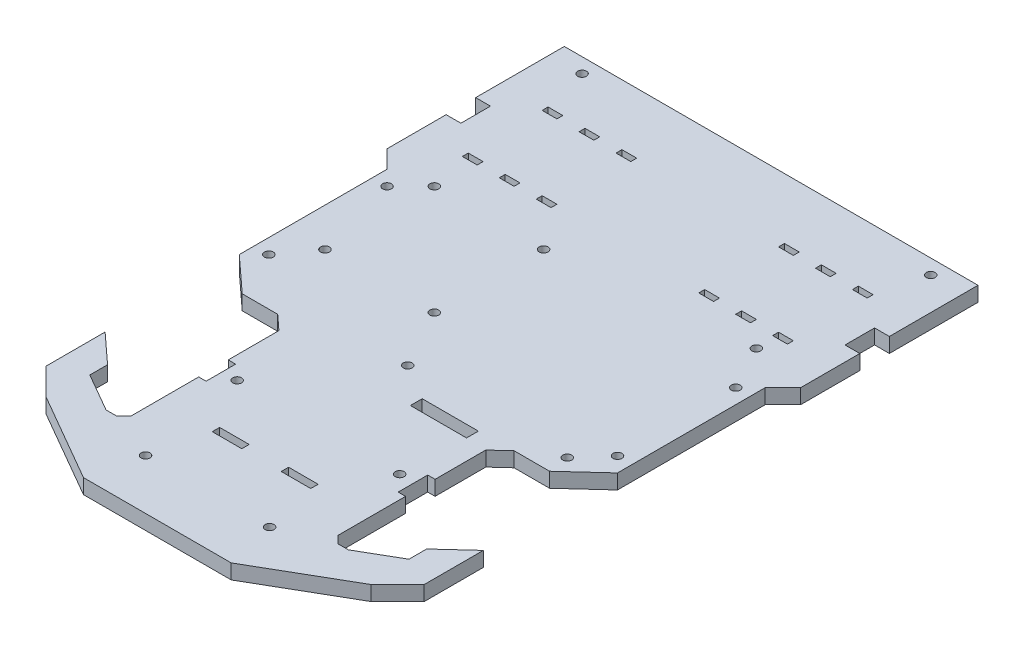
from build123d import *

# Parameters (mm, degrees)
SKETCH1_R               = 1.5
SKETCH1_W               = 5
SKETCH1_H               = 2
BOSS_EXTRUDE1_DEPTH     = 5
SENSOR_POS_R            = 1.5
SENSOR_POS_W            = 2.5
SENSOR_POS_H            = 10
SENSOR_POS_W_2          = 19
SENSOR_POS_H_2          = 4
SENSOR_POS_W_3          = 10
SENSOR_POS_H_3          = 2.5
CUT_EXTRUDE1_DEPTH      = 220.265652723
CUT_EXTRUDE2_DEPTH      = 220.265652723
CUT_EXTRUDE2_DEPTH_BACK = 220.265652723
SKETCH2_R               = 1.5


with BuildPart() as part:
    # Sketch1 → Boss-Extrude1 (new body)
    with BuildSketch(Plane(origin=(0, 0, 0), x_dir=(1, 0, 0), z_dir=(0, 1, 0))):
        Polygon((55, -190.411113167), (64, -181.411113167), (64, -161.411113167), (54, -170.577779834), (54, -176.577779834), (41, -184.083333333), (37.5, -184.083333333), (35, -181.583333333), (35, -131.583333333), (40, -127), (52, -127), (64, -116), (64, -66), (70, -60), (70, -40), (65, -40), (65, -30), (70, -30), (70, 0), (-70, 0), (-70, -30), (-65, -30), (-65, -40), (-70, -40), (-70, -60), (-64, -66), (-64, -116), (-52, -127), (-40, -127), (-35, -131.583333333), (-35, -181.583333333), (-37.5, -184.083333333), (-41, -184.083333333), (-54, -176.577779834), (-54, -170.577779834), (-64, -161.411113167), (-64, -181.411113167), (-55, -190.411113167), (-25, -207.731621243), (25, -207.731621243), align=None)
        with Locations(Location((59, -5, 0), (0, 0, 270))):
            Circle(SKETCH1_R, mode=Mode.SUBTRACT)
        with Locations(Location((59, -71, 0), (0, 0, 270))):
            Circle(SKETCH1_R, mode=Mode.SUBTRACT)
        with Locations(Location((59, -111, 0), (0, 0, 270))):
            Circle(SKETCH1_R, mode=Mode.SUBTRACT)
        with Locations(Location((-59, -111, 0), (0, 0, 90))):
            Circle(SKETCH1_R, mode=Mode.SUBTRACT)
        with Locations(Location((-59, -71, 0), (0, 0, 90))):
            Circle(SKETCH1_R, mode=Mode.SUBTRACT)
        with Locations(Location((-59, -5, 0), (0, 0, 90))):
            Circle(SKETCH1_R, mode=Mode.SUBTRACT)
        with Locations((52.5, -21.5)):
            Rectangle(SKETCH1_W, SKETCH1_H, mode=Mode.SUBTRACT)
        with Locations((40, -21.5)):
            Rectangle(SKETCH1_W, SKETCH1_H, mode=Mode.SUBTRACT)
        with Locations((27.5, -21.5)):
            Rectangle(SKETCH1_W, SKETCH1_H, mode=Mode.SUBTRACT)
        with Locations((52.5, -48.5)):
            Rectangle(SKETCH1_W, SKETCH1_H, mode=Mode.SUBTRACT)
        with Locations((40, -48.5)):
            Rectangle(SKETCH1_W, SKETCH1_H, mode=Mode.SUBTRACT)
        with Locations((27.5, -48.5)):
            Rectangle(SKETCH1_W, SKETCH1_H, mode=Mode.SUBTRACT)
        with Locations((-52.5, -48.5)):
            Rectangle(SKETCH1_W, SKETCH1_H, mode=Mode.SUBTRACT)
        with Locations((-40, -48.5)):
            Rectangle(SKETCH1_W, SKETCH1_H, mode=Mode.SUBTRACT)
        with Locations((-27.5, -48.5)):
            Rectangle(SKETCH1_W, SKETCH1_H, mode=Mode.SUBTRACT)
        with Locations((-52.5, -21.5)):
            Rectangle(SKETCH1_W, SKETCH1_H, mode=Mode.SUBTRACT)
        with Locations((-40, -21.5)):
            Rectangle(SKETCH1_W, SKETCH1_H, mode=Mode.SUBTRACT)
        with Locations((-27.5, -21.5)):
            Rectangle(SKETCH1_W, SKETCH1_H, mode=Mode.SUBTRACT)
    extrude(amount=BOSS_EXTRUDE1_DEPTH)

    # Sensor Pos → Cut-Extrude1 (cut, through all)
    with BuildSketch(Plane.XZ):
        with Locations(Location((27.5, 153.231621243, 0), (0, 0, 270))):
            Circle(SENSOR_POS_R)
        with Locations(Location((-27.5, 153.231621243, 0), (0, 0, 270))):
            Circle(SENSOR_POS_R)
        with Locations(Location((-21, 190.731621243, 0), (0, 0, 270))):
            Circle(SENSOR_POS_R)
        with Locations(Location((21, 190.731621243, 0), (0, 0, 270))):
            Circle(SENSOR_POS_R)
        with Locations((-33.75, 153.731621243)):
            Rectangle(SENSOR_POS_W, SENSOR_POS_H)
        with Locations((33.75, 153.731621243)):
            Rectangle(SENSOR_POS_W, SENSOR_POS_H)
        with Locations((18.7, 129.291666667)):
            Rectangle(SENSOR_POS_W_2, SENSOR_POS_H_2)
        with Locations((-11.666666667, 171.231621243)):
            Rectangle(SENSOR_POS_W_3, SENSOR_POS_H_3)
        with Locations((11.666666667, 171.231621243)):
            Rectangle(SENSOR_POS_W_3, SENSOR_POS_H_3)
    extrude(amount=-CUT_EXTRUDE1_DEPTH, mode=Mode.SUBTRACT)

    # Sketch2 → Cut-Extrude2 (cut, two sides: drawn at the far end of the back side and taken through both)
    with BuildSketch(Plane(origin=(0, 5, 0), x_dir=(1, 0, 0), z_dir=(0, 1, 0)).offset(-CUT_EXTRUDE2_DEPTH_BACK)):
        with Locations(Location((-51, -63, 0), (0, 0, 270))):
            Circle(SKETCH2_R)
        with Locations(Location((-14, -63, 0), (0, 0, 270))):
            Circle(SKETCH2_R)
        with Locations(Location((-51, -100, 0), (0, 0, 270))):
            Circle(SKETCH2_R)
        with Locations(Location((-14, -100, 0), (0, 0, 270))):
            Circle(SKETCH2_R)
        with Locations(Location((51, -56, 0), (0, 0, 270))):
            Circle(SKETCH2_R)
        with Locations(Location((-3, -120, 0), (0, 0, 270))):
            Circle(SKETCH2_R)
        with Locations(Location((51, -120, 0), (0, 0, 270))):
            Circle(SKETCH2_R)
    extrude(amount=CUT_EXTRUDE2_DEPTH + CUT_EXTRUDE2_DEPTH_BACK, mode=Mode.SUBTRACT)


solid = part.part
